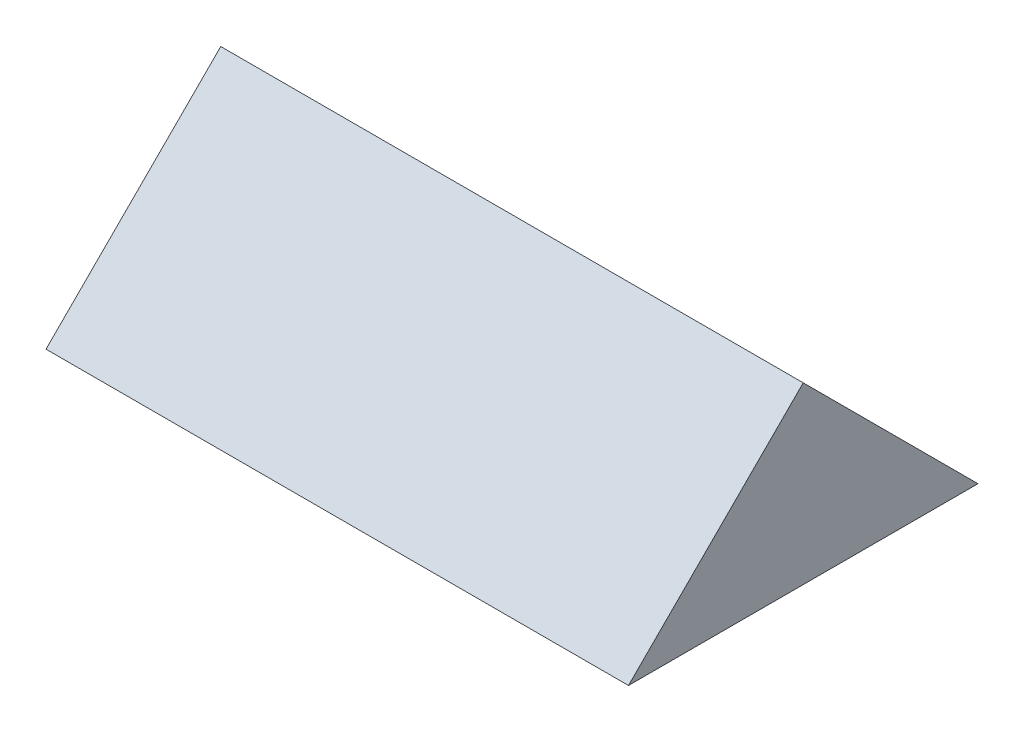
from build123d import *

# Parameters (mm, degrees)
BOSS_EXTRUDE1_DEPTH = 12192
SHELL1_T            = -304.8


with BuildPart() as part:
    # Sketch1 → Boss-Extrude1 (new body)
    with BuildSketch(Plane(origin=(0, 0, 0), x_dir=(0, 0, -1), z_dir=(1, 0, 0))):
        Polygon((0, 0), (7315.2, 0), (3657.6, 3657.6), align=None)
    extrude(amount=BOSS_EXTRUDE1_DEPTH)

    # Shell1
    shell1_openings = [part.faces().sort_by_distance(p)[0] for p in [
        (6096, 0, -3657.6),
    ]]
    offset(amount=SHELL1_T, openings=shell1_openings, kind=Kind.INTERSECTION)


solid = part.part
